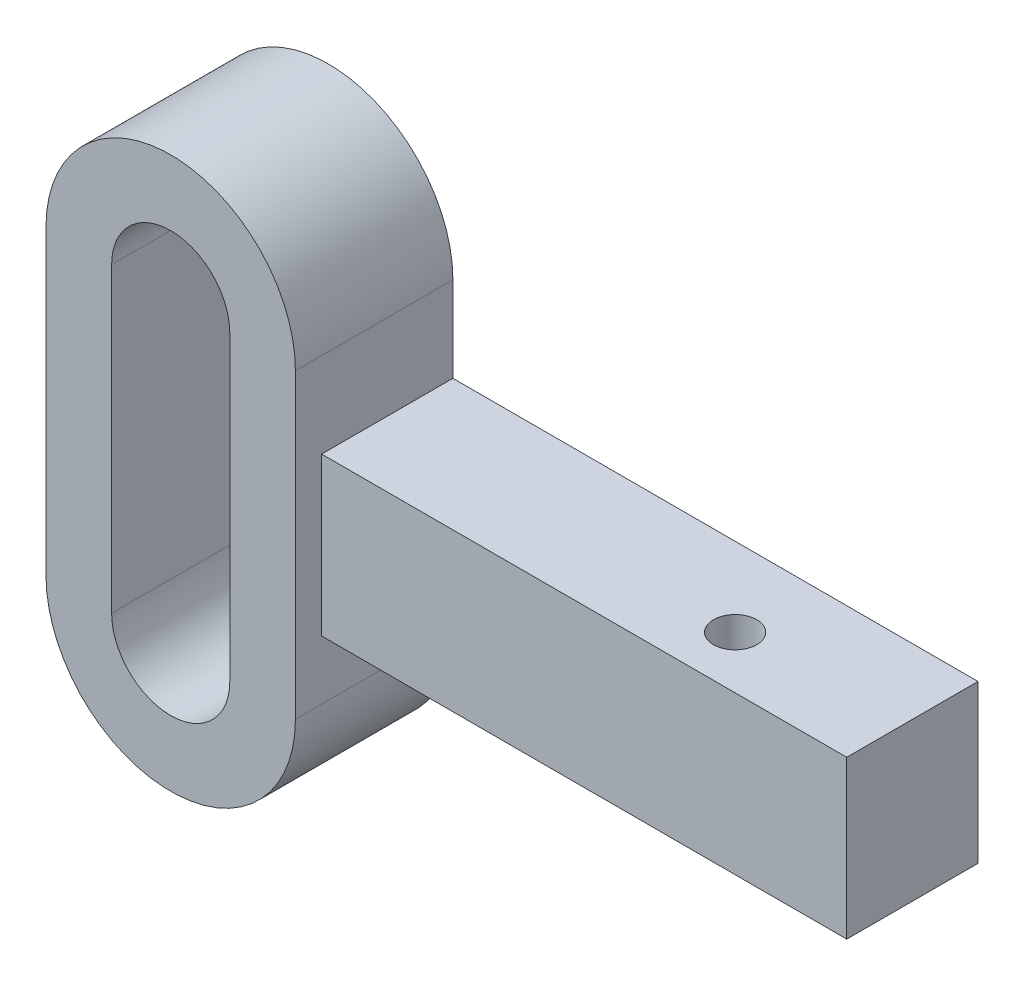
from build123d import *

# Parameters (mm, degrees)
BOSS_EXTRUDE1_DEPTH = 12
CUT_EXTRUDE1_DEPTH  = 26.98557292
SKETCH4_W           = 40
SKETCH4_H           = 12
BOSS_EXTRUDE2_DEPTH = 10
M4_TAPPED_HOLE1_D   = 3.3


with BuildPart() as part:
    # Sketch3 → Boss-Extrude1 (new body)
    with BuildSketch(Plane.XY):
        with BuildLine():
            Line((9.5, 11.5), (9.5, -11.5))
            ThreePointArc((9.5, -11.5), (0, -21), (-9.5, -11.5))
            Line((-9.5, -11.5), (-9.5, 11.5))
            ThreePointArc((-9.5, 11.5), (0, 21), (9.5, 11.5))
        make_face()
    extrude(amount=BOSS_EXTRUDE1_DEPTH)

    # Sketch1 → Cut-Extrude1 (cut, through all)
    with BuildSketch(Plane.XY):
        with BuildLine():
            Line((4.5, 11.5), (4.5, -11.5))
            ThreePointArc((4.5, -11.5), (0, -16), (-4.5, -11.5))
            Line((-4.5, -11.5), (-4.5, 11.5))
            ThreePointArc((-4.5, 11.5), (0, 16), (4.5, 11.5))
        make_face()
    extrude(amount=CUT_EXTRUDE1_DEPTH, mode=Mode.SUBTRACT)

    # Sketch4 → Boss-Extrude2 (add)
    with BuildSketch(Plane.XY):
        with Locations((29.5, -1)):
            Rectangle(SKETCH4_W, SKETCH4_H)
    extrude(amount=BOSS_EXTRUDE2_DEPTH)

    # M4 Tapped Hole1 (through all)
    with Locations(Plane(origin=(0, -7, 0), x_dir=(-1, 0, 0), z_dir=(0, -1, 0))):
        with Locations((-37, -6)):
            Hole(M4_TAPPED_HOLE1_D / 2)


solid = part.part
